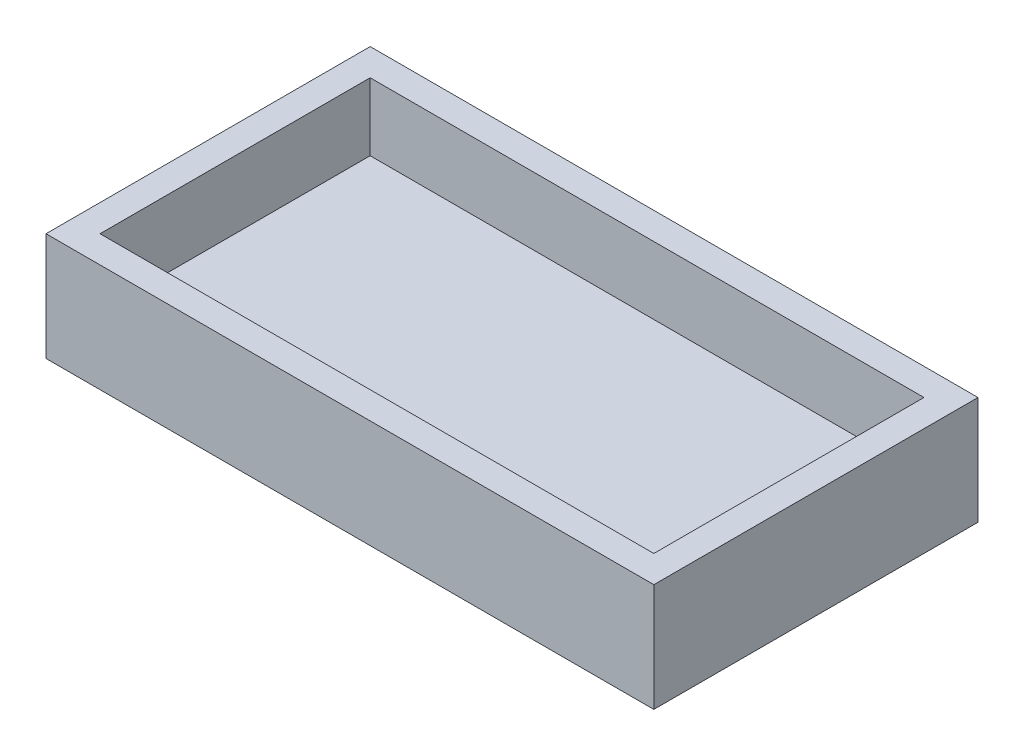
from build123d import *

# Parameters (mm, degrees)
SKETCH1_W           = 41
SKETCH1_H           = 20
BOSS_EXTRUDE1_DEPTH = 3
SKETCH2_W           = 45
SKETCH2_H           = 24
SKETCH2_W_2         = 41
SKETCH2_H_2         = 20
BOSS_EXTRUDE2_DEPTH = 8


with BuildPart() as part:
    # Sketch1 → Boss-Extrude1 (new body)
    with BuildSketch(Plane(origin=(0, 0, 0), x_dir=(1, 0, 0), z_dir=(0, 1, 0))):
        Rectangle(SKETCH1_W, SKETCH1_H)
    extrude(amount=BOSS_EXTRUDE1_DEPTH)

    # Sketch2 → Boss-Extrude2 (add)
    with BuildSketch(Plane.XZ):
        Rectangle(SKETCH2_W, SKETCH2_H)
        Rectangle(SKETCH2_W_2, SKETCH2_H_2, mode=Mode.SUBTRACT)
    extrude(amount=-BOSS_EXTRUDE2_DEPTH)


solid = part.part
